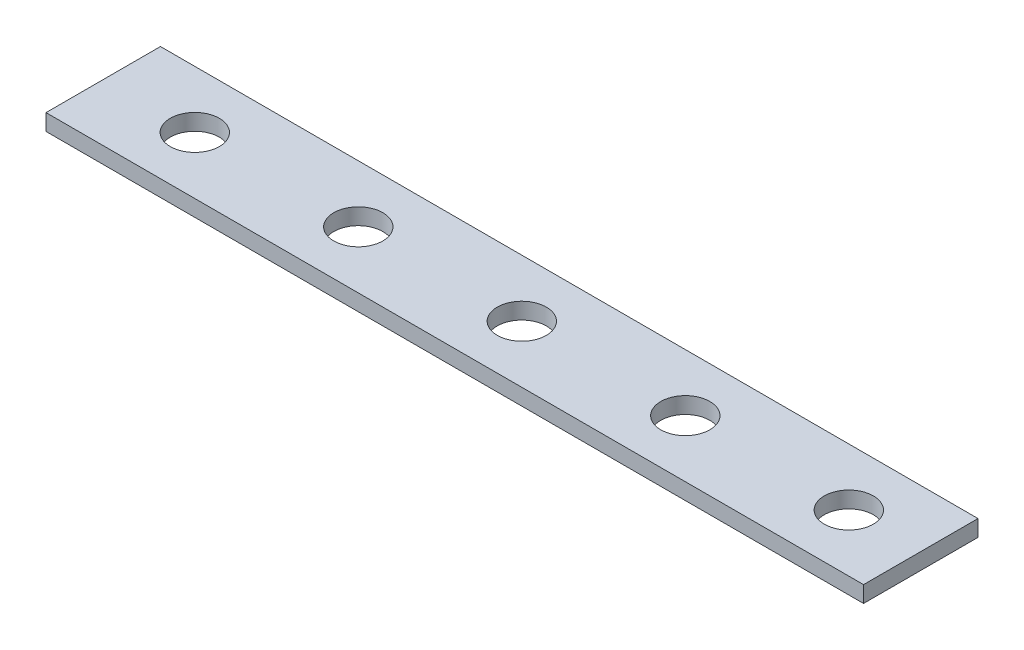
from build123d import *

# Parameters (mm, degrees)
SKETCH1_W           = 50
SKETCH1_H           = 7
BOSS_EXTRUDE1_DEPTH = 1
SKETCH2_R           = 1.5
CUT_EXTRUDE1_DEPTH  = 39.281330669
LPATTERN2_COUNT     = 5
LPATTERN2_PITCH     = 10


with BuildPart() as part:
    # Sketch1 → Boss-Extrude1 (new body)
    with BuildSketch(Plane(origin=(0, 0, 0), x_dir=(1, 0, 0), z_dir=(0, 1, 0))):
        with Locations((-8.6, 14.816666667)):
            Rectangle(SKETCH1_W, SKETCH1_H)
    extrude(amount=BOSS_EXTRUDE1_DEPTH)

    # Sketch2 → Cut-Extrude1 (cut, through all)
    with BuildSketch(Plane(origin=(0, 1, 0), x_dir=(1, 0, 0), z_dir=(0, 1, 0))):
        with Locations(Location((-28.000173189, 14.816666667, 0), (0, 0, 270))):
            Circle(SKETCH2_R)
    cut_extrude1 = extrude(amount=-CUT_EXTRUDE1_DEPTH, mode=Mode.SUBTRACT)

    # LPattern2: Cut-Extrude1 ×5
    with Locations(*[(i * LPATTERN2_PITCH, 0, 0) for i in range(1, LPATTERN2_COUNT)]):
        add(cut_extrude1, mode=Mode.SUBTRACT)


solid = part.part
